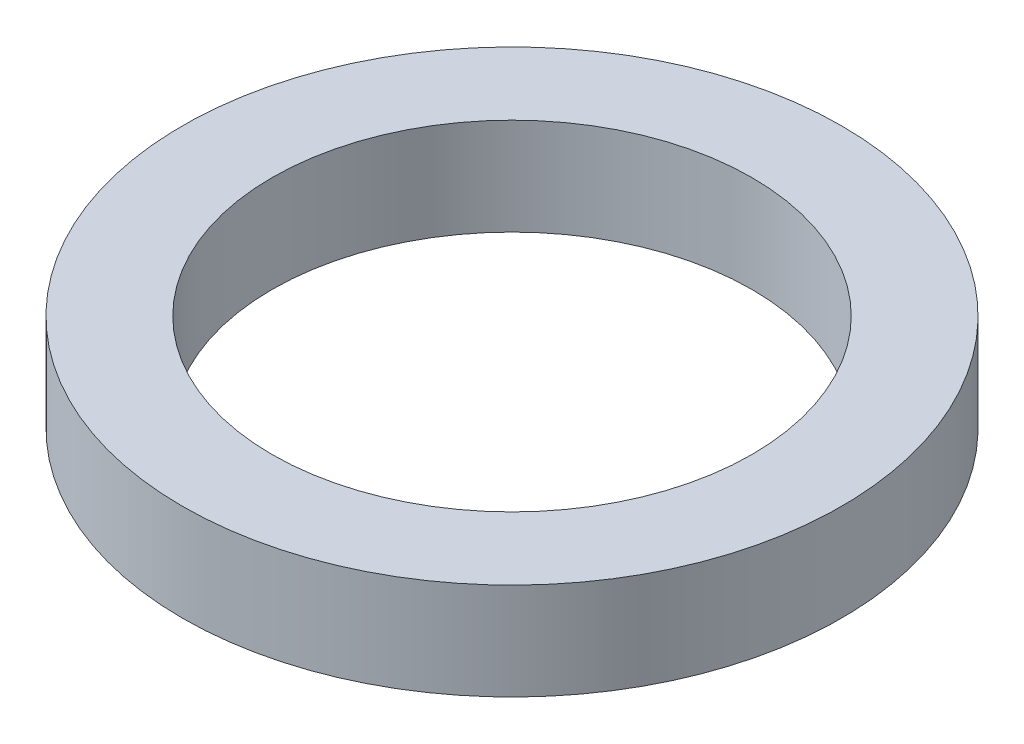
from build123d import *

# Parameters (mm, degrees)
SKETCH1_R           = 13.6
SKETCH1_R_2         = 9.9
BOSS_EXTRUDE1_DEPTH = 4


with BuildPart() as part:
    # Sketch1 → Boss-Extrude1 (new body)
    with BuildSketch(Plane(origin=(0, 0, 0), x_dir=(1, 0, 0), z_dir=(0, 1, 0))):
        with Locations(Location((0, 0, 0), (0, 0, 270))):
            Circle(SKETCH1_R)
        with Locations(Location((0, 0, 0), (0, 0, 270))):
            Circle(SKETCH1_R_2, mode=Mode.SUBTRACT)
    extrude(amount=BOSS_EXTRUDE1_DEPTH)


solid = part.part
